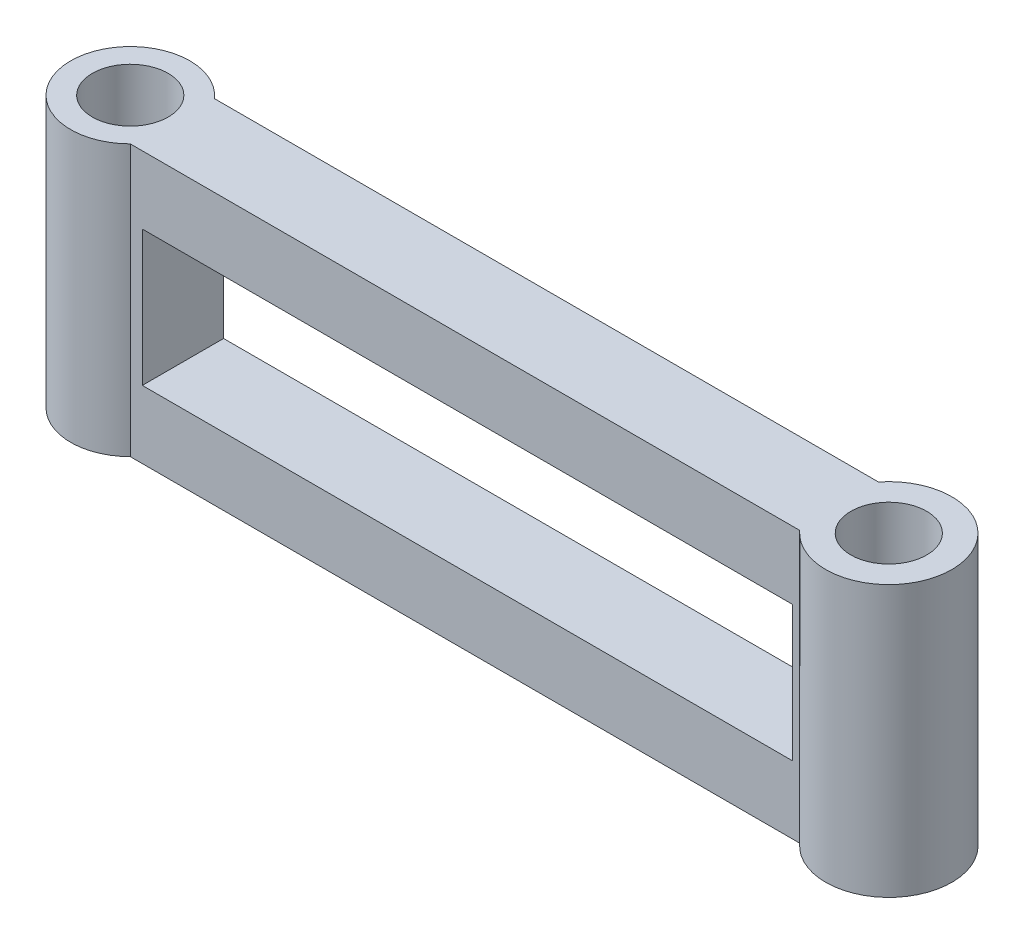
from build123d import *

# Parameters (mm, degrees)
SKETCH1_R           = 8.89
BOSS_EXTRUDE1_DEPTH = 63.5
SKETCH2_W           = 152.4
SKETCH2_H           = 31.75
CUT_EXTRUDE1_DEPTH  = 135.858873196


with BuildPart() as part:
    # Sketch1 → Boss-Extrude1 (new body)
    with BuildSketch(Plane(origin=(0, 0, 0), x_dir=(1, 0, 0), z_dir=(0, 1, 0))):
        with BuildLine():
            Line((-65.662425135, 1.387847299), (89.999471876, 1.387847299))
            ThreePointArc((89.999471876, 1.387847299), (116.381042824, -7.321873409), (90.594900331, -17.662152701))
            Line((90.594900331, -17.662152701), (-66.321718267, -17.662152701))
            ThreePointArc((-66.321718267, -17.662152701), (-90.161641206, -7.300678624), (-65.662425135, 1.387847299))
        make_face()
        with Locations(Location((101.6, -7.783870968, 0), (0, 0, 270))):
            Circle(SKETCH1_R, mode=Mode.SUBTRACT)
        with Locations(Location((-76.2, -7.783870968, 0), (0, 0, 270))):
            Circle(SKETCH1_R, mode=Mode.SUBTRACT)
    extrude(amount=BOSS_EXTRUDE1_DEPTH)

    # Sketch2 → Cut-Extrude1 (cut, through all)
    with BuildSketch(Plane.XY.offset(17.662152701)):
        with Locations((12.7, 31.75)):
            Rectangle(SKETCH2_W, SKETCH2_H)
    extrude(amount=-CUT_EXTRUDE1_DEPTH, mode=Mode.SUBTRACT)


solid = part.part
